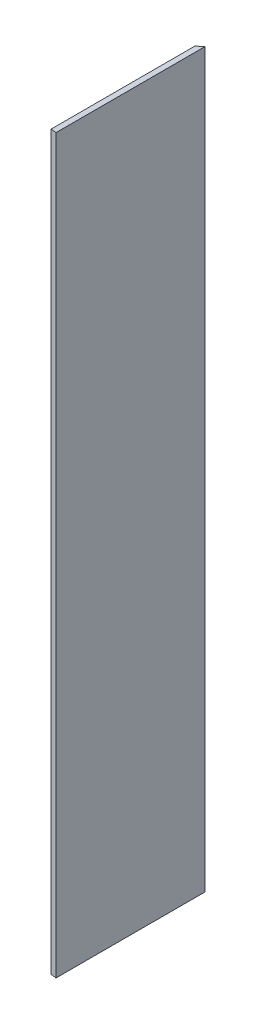
from build123d import *

# Parameters (mm, degrees)
EXTRUDE_1_DEPTH = 533


with BuildPart() as part:
    # Эскиз1 → Вытянуть1 (new body)
    with BuildSketch(Plane(origin=(0, 0, 0), x_dir=(1, 0, 0), z_dir=(0, 1, 0))):
        Polygon((1.026379046, -2.632597563), (1.026379046, -107.324896908), (5.026379046, -107.838799799), (5.026379046, 0.491200201), align=None)
    extrude(amount=EXTRUDE_1_DEPTH)


solid = part.part
